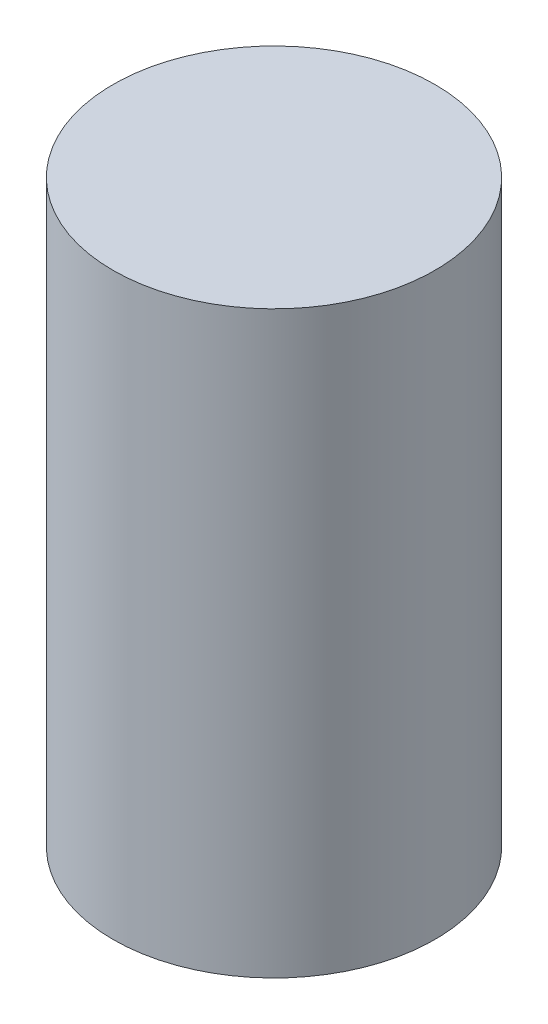
from build123d import *

# Parameters (mm, degrees)
SKETCH_1_R      = 10
EXTRUDE_1_DEPTH = 36


with BuildPart() as part:
    # 草图1 → 凸台-拉伸1 (new body)
    with BuildSketch(Plane(origin=(0, 0, 0), x_dir=(1, 0, 0), z_dir=(0, 1, 0))):
        with Locations(Location((-33.611736718, 0, 0), (0, 0, 270))):
            Circle(SKETCH_1_R)
    extrude(amount=EXTRUDE_1_DEPTH)


solid = part.part
